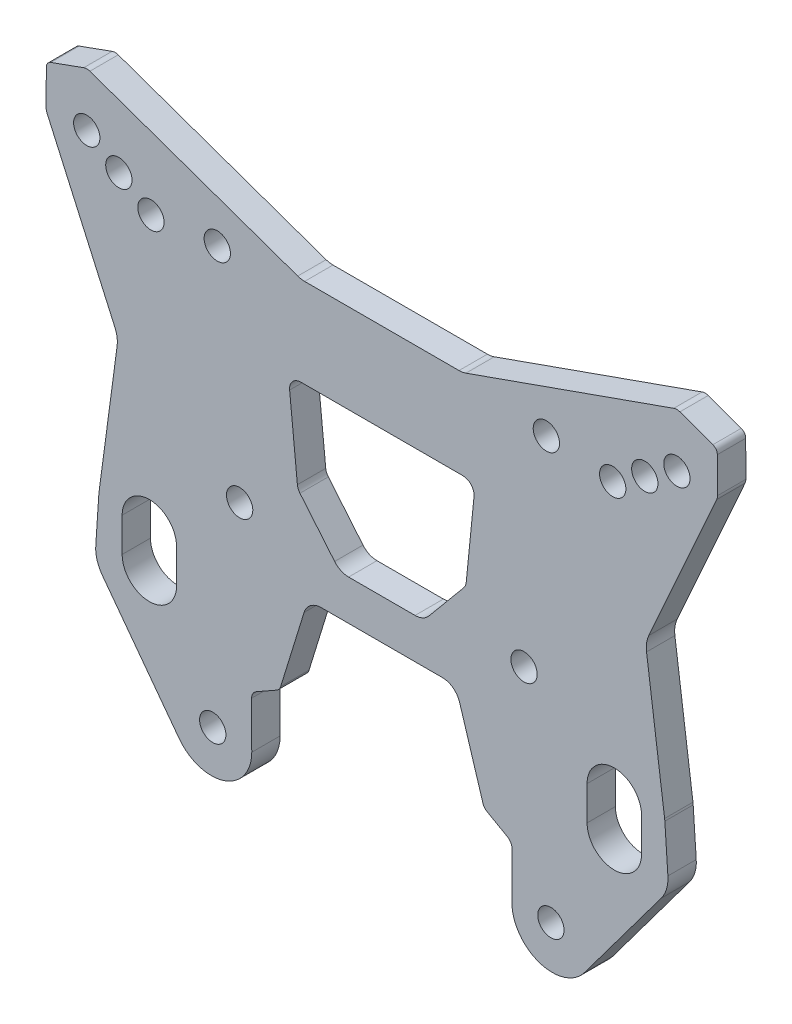
from build123d import *

# Parameters (mm, degrees)
BOSS_EXTRUDE1_DEPTH = 3.175
SKETCH2_R           = 1.4732
CUT_EXTRUDE1_DEPTH  = 66.187440595


with BuildPart() as part:
    # Sketch1 → Boss-Extrude1 (new body)
    with BuildSketch(Plane.XY):
        with BuildLine():
            Line((-8.644986321, 0), (8.644986321, 0))
            ThreePointArc((8.644986321, 0), (9.036676671, 0.033358008), (9.41708521, 0.132471226))
            Line((9.41708521, 0.132471226), (32.695027169, 8.362466532))
            ThreePointArc((32.695027169, 8.362466532), (33.037413575, 8.420565737), (33.379365385, 8.359961043))
            Line((33.379365385, 8.359961043), (37.074831276, 7.022895104))
            ThreePointArc((37.074831276, 7.022895104), (37.438600447, 6.745086623), (37.577573101, 6.308976358))
            Line((37.577573101, 6.308976358), (37.591246654, 2.336170232))
            ThreePointArc((37.591246654, 2.336170232), (37.569195736, 2.122118926), (37.502559227, 1.917512522))
            Line((37.502559227, 1.917512522), (29.896170993, -15.072175319))
            ThreePointArc((29.896170993, -15.072175319), (29.651900561, -15.913690011), (29.646955985, -16.789926606))
            Line((29.646955985, -16.789926606), (31.669948024, -31.934678241))
            ThreePointArc((31.669948024, -31.934678241), (31.684578491, -32.059980985), (31.695052571, -32.185699407))
            Line((31.695052571, -32.185699407), (32.037376325, -37.320766007))
            ThreePointArc((32.037376325, -37.320766007), (31.88963719, -38.653858534), (31.289084234, -39.853149444))
            Line((31.289084234, -39.853149444), (22.711313793, -51.345361524))
            ThreePointArc((22.711313793, -51.345361524), (17.658131065, -52.930106933), (14.566913248, -48.630055061))
            Line((14.566913248, -48.630055061), (14.5796, -43.389351757))
            ThreePointArc((14.5796, -43.389351757), (14.441970337, -42.876278099), (14.064222513, -42.502790371))
            Line((14.064222513, -42.502790371), (11.798676805, -41.21993315))
            ThreePointArc((11.798676805, -41.21993315), (11.507576341, -40.972569428), (11.3284, -40.635191111))
            Line((11.3284, -40.635191111), (8.709628272, -32.14188038))
            ThreePointArc((8.709628272, -32.14188038), (7.974572044, -31.105726569), (6.767835591, -30.7086))
            Line((6.767835591, -30.7086), (-6.767835591, -30.7086))
            ThreePointArc((-6.767835591, -30.7086), (-7.974572044, -31.105726569), (-8.709628272, -32.14188038))
            Line((-8.709628272, -32.14188038), (-11.3284, -40.635191111))
            ThreePointArc((-11.3284, -40.635191111), (-11.507576341, -40.972569428), (-11.798676805, -41.21993315))
            Line((-11.798676805, -41.21993315), (-14.064222513, -42.502790371))
            ThreePointArc((-14.064222513, -42.502790371), (-14.441970337, -42.876278099), (-14.5796, -43.389351757))
            Line((-14.5796, -43.389351757), (-14.566913248, -48.630055061))
            ThreePointArc((-14.566913248, -48.630055061), (-17.658131065, -52.930106933), (-22.711313793, -51.345361524))
            Line((-22.711313793, -51.345361524), (-31.289084234, -39.853149444))
            ThreePointArc((-31.289084234, -39.853149444), (-31.88963719, -38.653858534), (-32.037376325, -37.320766007))
            Line((-32.037376325, -37.320766007), (-31.695052571, -32.185699407))
            ThreePointArc((-31.695052571, -32.185699407), (-31.684578491, -32.059980985), (-31.669948024, -31.934678241))
            Line((-31.669948024, -31.934678241), (-29.646955985, -16.789926606))
            ThreePointArc((-29.646955985, -16.789926606), (-29.651900561, -15.913690011), (-29.896170993, -15.072175319))
            Line((-29.896170993, -15.072175319), (-37.502559227, 1.917512522))
            ThreePointArc((-37.502559227, 1.917512522), (-37.569195736, 2.122118926), (-37.591246654, 2.336170232))
            Line((-37.591246654, 2.336170232), (-37.577573101, 6.308976358))
            ThreePointArc((-37.577573101, 6.308976358), (-37.438600447, 6.745086623), (-37.074831276, 7.022895104))
            Line((-37.074831276, 7.022895104), (-33.379365385, 8.359961043))
            ThreePointArc((-33.379365385, 8.359961043), (-33.037413575, 8.420565737), (-32.695027169, 8.362466532))
            Line((-32.695027169, 8.362466532), (-9.41708521, 0.132471226))
            ThreePointArc((-9.41708521, 0.132471226), (-9.036676671, 0.033358008), (-8.644986321, 0))
        make_face()
        with BuildLine():
            Line((-3.720594556, -26.2128), (3.720594556, -26.2128))
            ThreePointArc((3.720594556, -26.2128), (4.583419353, -26.020516655), (5.282950018, -25.480057253))
            Line((5.282950018, -25.480057253), (9.168332687, -20.807888736))
            ThreePointArc((9.168332687, -20.807888736), (9.363351592, -20.486269793), (9.455616357, -20.121635275))
            Line((9.455616357, -20.121635275), (10.325877008, -11.377982322))
            ThreePointArc((10.325877008, -11.377982322), (10.003567813, -10.39980442), (9.062121174, -9.9822))
            Line((9.062121174, -9.9822), (-9.062121174, -9.9822))
            ThreePointArc((-9.062121174, -9.9822), (-10.003567813, -10.39980442), (-10.325877008, -11.377982322))
            Line((-10.325877008, -11.377982322), (-9.455616357, -20.121635275))
            ThreePointArc((-9.455616357, -20.121635275), (-9.363351592, -20.486269793), (-9.168332687, -20.807888736))
            Line((-9.168332687, -20.807888736), (-5.282950018, -25.480057253))
            ThreePointArc((-5.282950018, -25.480057253), (-4.583419353, -26.020516655), (-3.720594556, -26.2128))
        make_face(mode=Mode.SUBTRACT)
    extrude(amount=BOSS_EXTRUDE1_DEPTH)

    # Sketch2 → Cut-Extrude1 (cut, through all)
    with BuildSketch(Plane.XY.offset(3.175)):
        with Locations((33.0454, 2.451609921)):
            Circle(SKETCH2_R)
        with Locations((29.4513, 0.151296675)):
            Circle(SKETCH2_R)
        with Locations((25.8572, -2.149016571)):
            Circle(SKETCH2_R)
        with Locations((18.4277, -1.450311364)):
            Circle(SKETCH2_R)
        with Locations((15.9258, -25.093922391)):
            Circle(SKETCH2_R)
        with Locations((18.9357, -48.395328507)):
            Circle(SKETCH2_R)
        with Locations(Location((-18.9357, -48.395328507, 0), (0, 0, 180))):
            Circle(SKETCH2_R)
        with Locations(Location((-15.9258, -25.093922391, 0), (0, 0, 180))):
            Circle(SKETCH2_R)
        with Locations(Location((-18.4277, -1.450311364, 0), (0, 0, 180))):
            Circle(SKETCH2_R)
        with Locations(Location((-25.8572, -2.149016571, 0), (0, 0, 180))):
            Circle(SKETCH2_R)
        with Locations(Location((-29.4513, 0.151296675, 0), (0, 0, 180))):
            Circle(SKETCH2_R)
        with Locations(Location((-33.0454, 2.451609921, 0), (0, 0, 180))):
            Circle(SKETCH2_R)
        with BuildLine():
            Line((29.083, -32.893), (29.083, -36.703))
            ThreePointArc((29.083, -36.703), (26.035, -39.751), (22.987, -36.703))
            Line((22.987, -36.703), (22.987, -32.893))
            ThreePointArc((22.987, -32.893), (26.035, -29.845), (29.083, -32.893))
        make_face()
        with BuildLine():
            Line((-29.083, -32.893), (-29.083, -36.703))
            ThreePointArc((-29.083, -36.703), (-26.035, -39.751), (-22.987, -36.703))
            Line((-22.987, -36.703), (-22.987, -32.893))
            ThreePointArc((-22.987, -32.893), (-26.035, -29.845), (-29.083, -32.893))
        make_face()
    extrude(amount=-CUT_EXTRUDE1_DEPTH, mode=Mode.SUBTRACT)


solid = part.part
